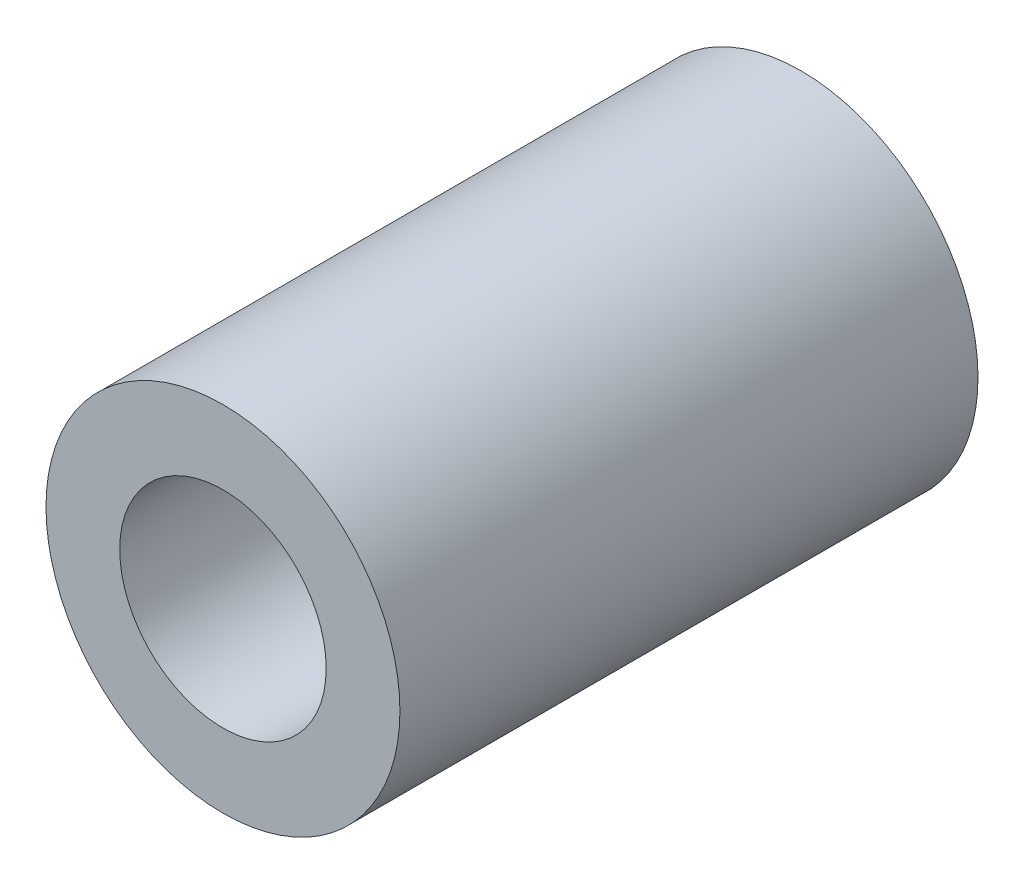
from build123d import *

# Parameters (mm, degrees)
SKETCH_1_R          = 30
EXTRUDE_1_DEPTH     = 98
SKETCH_2_R          = 17.5
CUT_EXTRUDE_1_DEPTH = 25
SKETCH_3_R          = 12.5
CUT_EXTRUDE_2_DEPTH = 25


with BuildPart() as part:
    # 草图1 → 凸台-拉伸1 (new body)
    with BuildSketch(Plane.XY):
        with Locations((-39.098360656, 16.475409836)):
            Circle(SKETCH_1_R)
    extrude(amount=EXTRUDE_1_DEPTH)

    # 草图2 → 切除-拉伸1 (cut)
    with BuildSketch(Plane.XY.offset(98)):
        with Locations((-39.098360656, 16.475409836)):
            Circle(SKETCH_2_R)
    extrude(amount=-CUT_EXTRUDE_1_DEPTH, mode=Mode.SUBTRACT)

    # 草图3 → 切除-拉伸2 (cut)
    with BuildSketch(Plane(origin=(0, 0, 0), x_dir=(-1, 0, 0), z_dir=(0, 0, -1))):
        with Locations((39.098360656, 16.475409836)):
            Circle(SKETCH_3_R)
    extrude(amount=-CUT_EXTRUDE_2_DEPTH, mode=Mode.SUBTRACT)


solid = part.part
